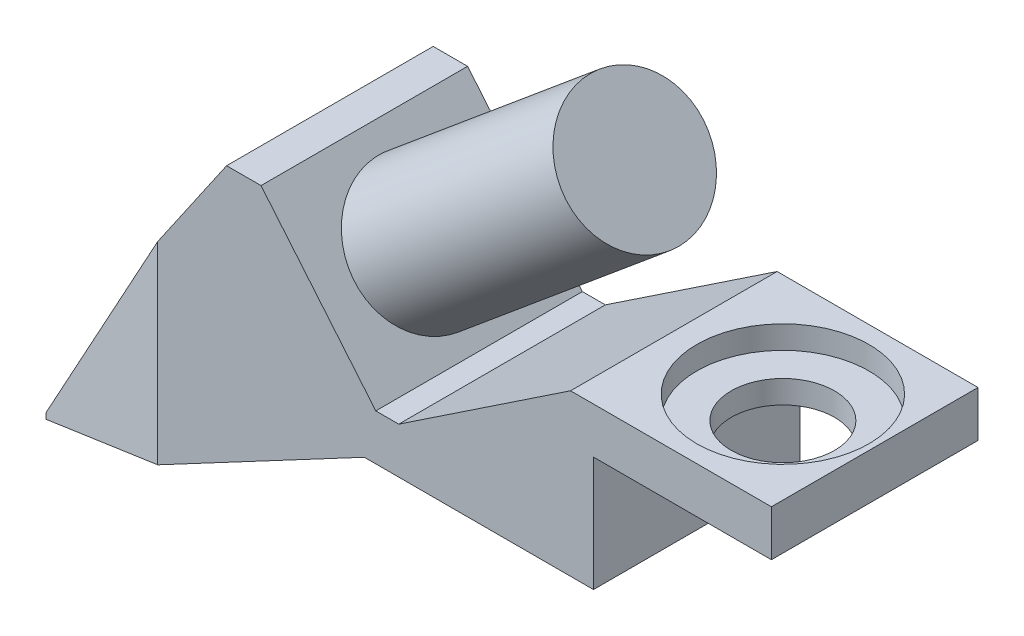
from build123d import *

# Parameters (mm, degrees)
BOSS_EXTRUDE1_DEPTH = 9
SKETCH2_R           = 2.25
CUT_EXTRUDE1_DEPTH  = 16.5
SKETCH2_3_R         = 3.75
SKETCH2_3_R_2       = 2.25
CUT_EXTRUDE2_DEPTH  = 1
SKETCH3_R           = 3
BOSS_EXTRUDE2_DEPTH = 12


with BuildPart() as part:
    # Sketch1 → Boss-Extrude1 (new body)
    with BuildSketch(Plane.XY):
        Polygon((0, 0), (17.866685226, 9.5), (27.85, 9.5), (27.85, 14.5), (35.6, 14.5), (35.6, 16.5), (26.85, 16.5), (19.366685226, 11.5), (18.366685226, 11.5), (13.366685226, 17.5), (11.866685226, 17.5), (0, 0.25), align=None)
    extrude(amount=BOSS_EXTRUDE1_DEPTH)

    # Sketch2 → Cut-Extrude1 (cut)
    with BuildSketch(Plane(origin=(0, 16.5, 0), x_dir=(1, 0, 0), z_dir=(0, 1, 0))):
        with Locations(Location((31.6, -4.5, 0), (0, 0, 270))):
            Circle(SKETCH2_R)
        Polygon((0, 0), (0, -4), (8.866685226, 0), align=None)
        Polygon((0, -5), (8.866685226, -9), (0, -9), align=None)
    extrude(amount=-CUT_EXTRUDE1_DEPTH, mode=Mode.SUBTRACT)

    # Sketch2<3> → Cut-Extrude2 (cut)
    with BuildSketch(Plane(origin=(0, 16.5, 0), x_dir=(1, 0, 0), z_dir=(0, 1, 0))):
        with Locations(Location((31.6, -4.5, 0), (0, 0, 270))):
            Circle(SKETCH2_3_R)
        with Locations(Location((31.6, -4.5, 0), (0, 0, 270))):
            Circle(SKETCH2_3_R_2, mode=Mode.SUBTRACT)
    extrude(amount=-CUT_EXTRUDE2_DEPTH, mode=Mode.SUBTRACT)

    # Sketch3 → Boss-Extrude2 (add)
    with BuildSketch(Plane(origin=(16.495092921, 13.745910767, 0), x_dir=(0, 0, -1), z_dir=(0.768221279597376, 0.6401843996644799, 0))):
        with Locations(Location((-4.5, 0.886729036, 0), (0, 0, 270))):
            Circle(SKETCH3_R)
    extrude(amount=BOSS_EXTRUDE2_DEPTH)


solid = part.part
